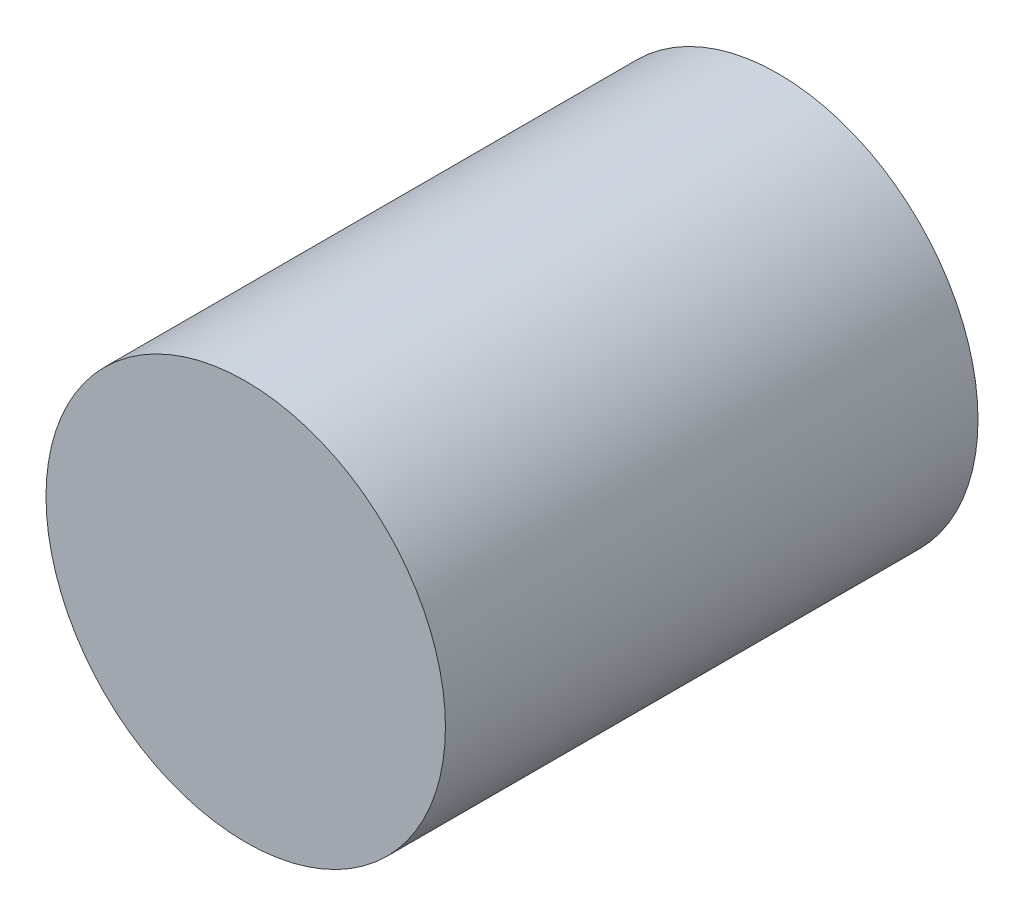
from build123d import *

# Parameters (mm, degrees)
SKETCH1_R      = 30
CYLINDER_DEPTH = 80


with BuildPart() as part:
    # Sketch1 → Cylinder (new body)
    with BuildSketch(Plane.XY):
        Circle(SKETCH1_R)
    extrude(amount=CYLINDER_DEPTH)


solid = part.part
